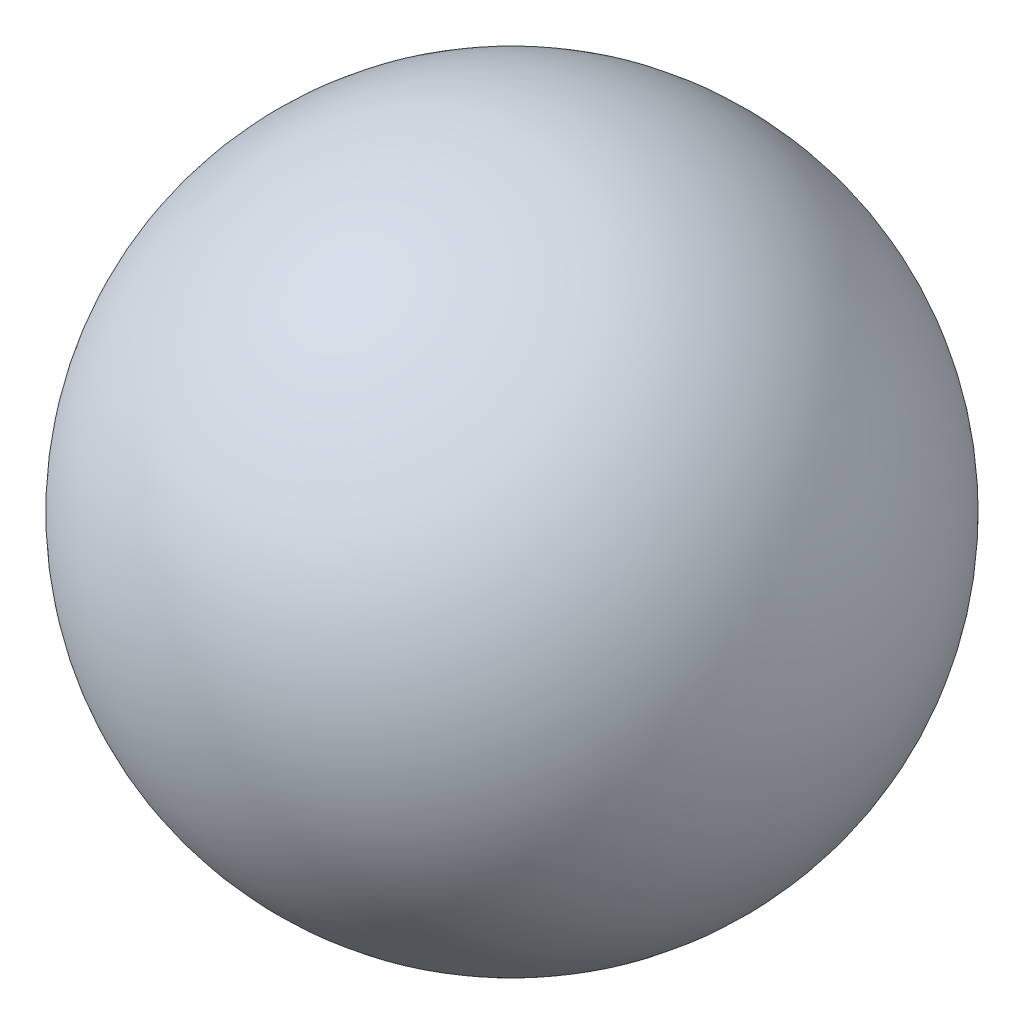
from build123d import *


with BuildPart() as part:
    # 草图1 → 旋转2 (revolve)
    with BuildSketch(Plane.XY):
        with BuildLine():
            Line((0, -120.5), (0, 120.5))
            ThreePointArc((0, 120.5), (-120.5, 0), (0, -120.5))
        make_face()
    revolve(axis=Axis((0, -1000, 0), (0, 1, 0)))


solid = part.part
